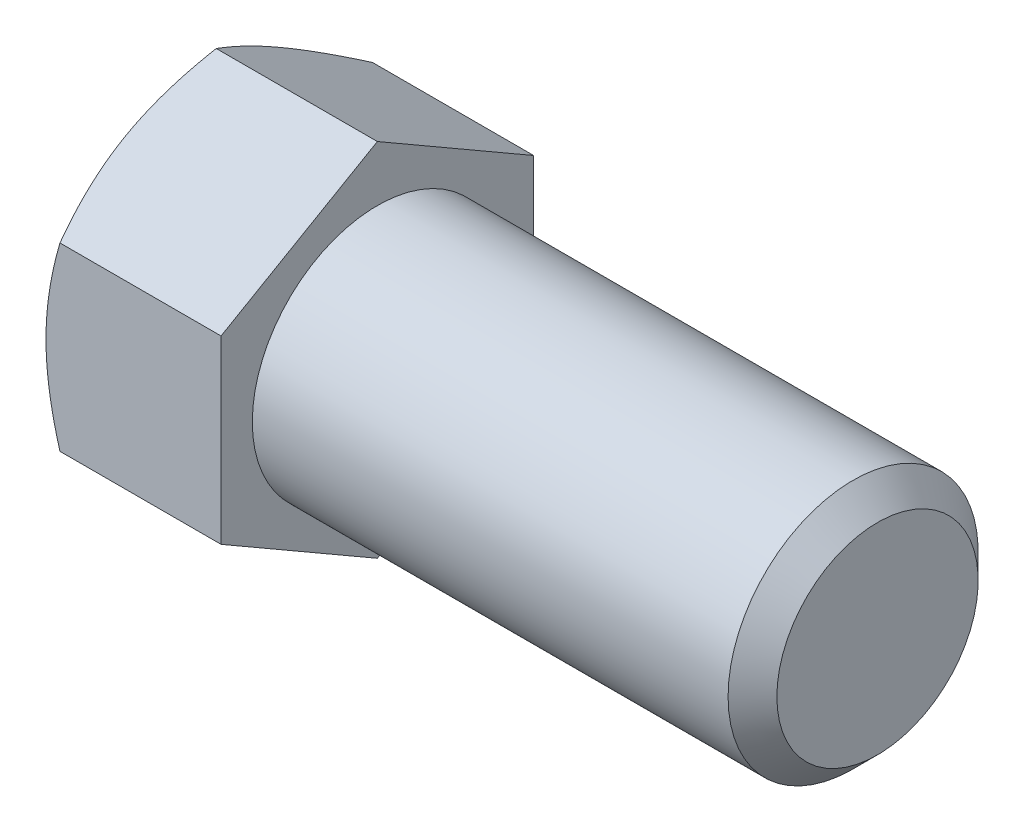
from build123d import *

# Parameters (mm, degrees)
BASEHEAD_DEPTH = 2.8


with BuildPart() as part:
    # Sketch1 → BaseHead (new body)
    with BuildSketch(Plane(origin=(0, 0, 0), x_dir=(0, 0, -1), z_dir=(1, 0, 0))):
        Polygon((2.5, 1.443375673), (2.5, -1.443375673), (0, -2.886751346), (-2.5, -1.443375673), (-2.5, 1.443375673), (0, 2.886751346), align=None)
    extrude(amount=BASEHEAD_DEPTH)

    # BodySke → BaseBody (revolve)
    with BuildSketch(Plane.XY, mode=Mode.PRIVATE) as basebody_sk:
        Polygon((0, 0), (10.8, 0), (10.8, 1.61), (10.41, 2), (0, 2), align=None)
    revolve(basebody_sk.sketch.rotate(Axis((0, 0, 0), (1, 0, 0)), 90), axis=Axis((0, 0, 0), (1, 0, 0)))

    # Sketch3 → HeadChamfer (revolve, cut)
    with BuildSketch(Plane.XY):
        Polygon((0, 2.5), (3.11004234, 7.886751346), (3.11004234, 12.886751346), (-10, 12.886751346), (-10, 2.5), align=None)
    revolve(axis=Axis((0, 0, 0), (1, 0, 0)), mode=Mode.SUBTRACT)


solid = part.part
